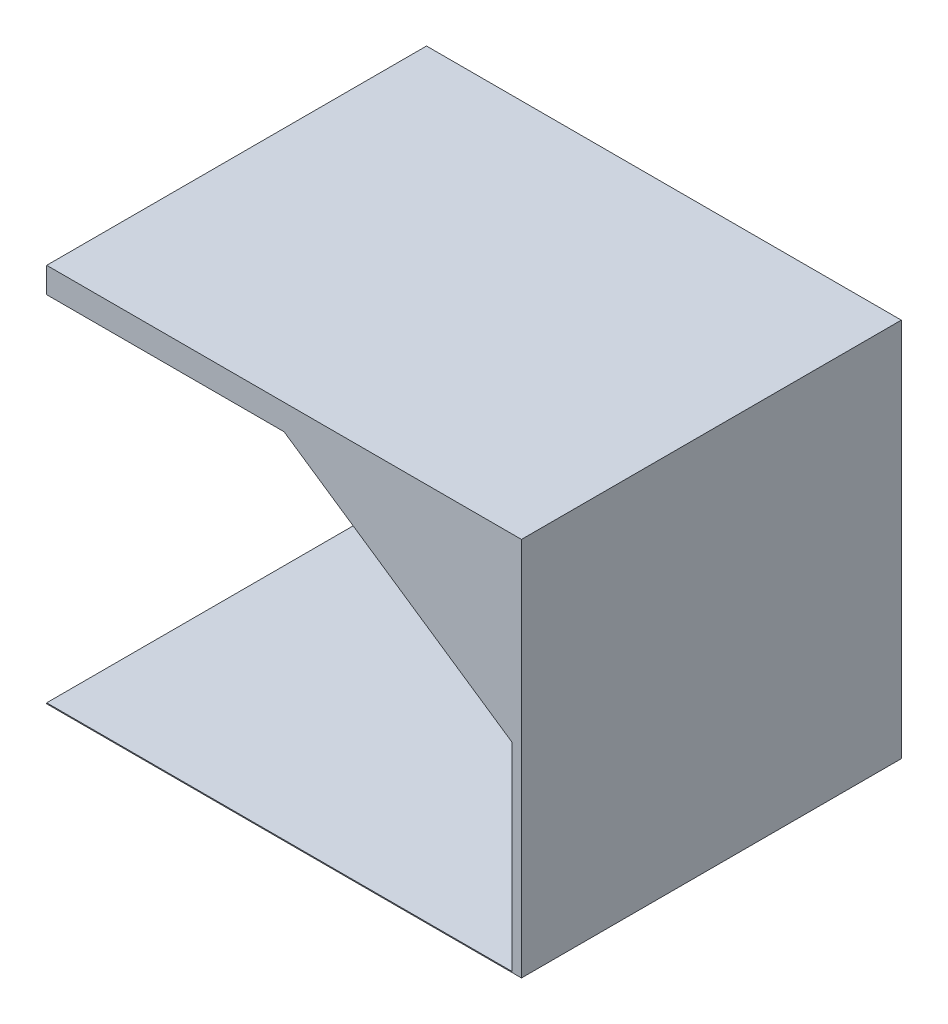
from build123d import *

# Parameters (mm, degrees)
SKETCH1_W               = 2500
SKETCH1_H               = 2000
BOSS_EXTRUDE1_DEPTH     = 2000
CUT_EXTRUDE4_DEPTH      = 2562.73769149
CUT_EXTRUDE4_DEPTH_BACK = 1995
SKETCH3_R               = 100
CUT_EXTRUDE5_DEPTH      = 20


with BuildPart() as part:
    # Sketch1 → Boss-Extrude1 (new body)
    with BuildSketch(Plane.XY):
        Rectangle(SKETCH1_W, SKETCH1_H)
    extrude(amount=BOSS_EXTRUDE1_DEPTH)

    # Sketch2 → Cut-Extrude4 (cut, two sides: drawn at the far end of the back side and taken through both)
    with BuildSketch(Plane.XY.offset(2000).offset(-CUT_EXTRUDE4_DEPTH_BACK)):
        Polygon((0, 865.900952839), (-1250, 865.900952839), (-1250, -995), (-950, -995), (1200, -995), (1200, 50.500700421), align=None)
    extrude(amount=CUT_EXTRUDE4_DEPTH + CUT_EXTRUDE4_DEPTH_BACK, mode=Mode.SUBTRACT)

    # Sketch3 → Cut-Extrude5 (cut)
    with BuildSketch(Plane(origin=(402.525561596, 592.384749064, 0), x_dir=(0.8271186734212488, -0.5620273125728621, 0), z_dir=(-0.5620273125728621, -0.8271186734212488, 0))):
        with Locations((238.749824843, 1500)):
            Circle(SKETCH3_R)
        with Locations((238.749824843, 1002.5)):
            Circle(SKETCH3_R)
        with Locations((238.749824843, 500)):
            Circle(SKETCH3_R)
    extrude(amount=-CUT_EXTRUDE5_DEPTH, mode=Mode.SUBTRACT)


solid = part.part
